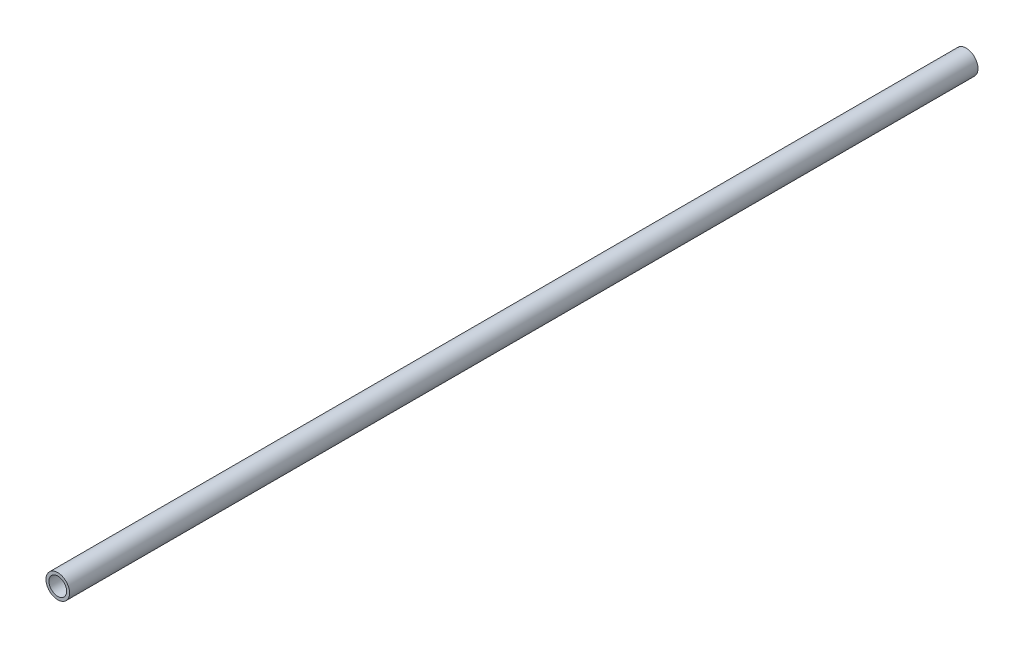
from build123d import *

# Parameters (mm, degrees)
SKETCH1_R              = 4
SKETCH1_R_2            = 3
COMPRESSION_TUBE_DEPTH = 308


with BuildPart() as part:
    # Sketch1 → Compression_Tube (new body)
    with BuildSketch(Plane.XY):
        Circle(SKETCH1_R)
        Circle(SKETCH1_R_2, mode=Mode.SUBTRACT)
    extrude(amount=COMPRESSION_TUBE_DEPTH)


solid = part.part
